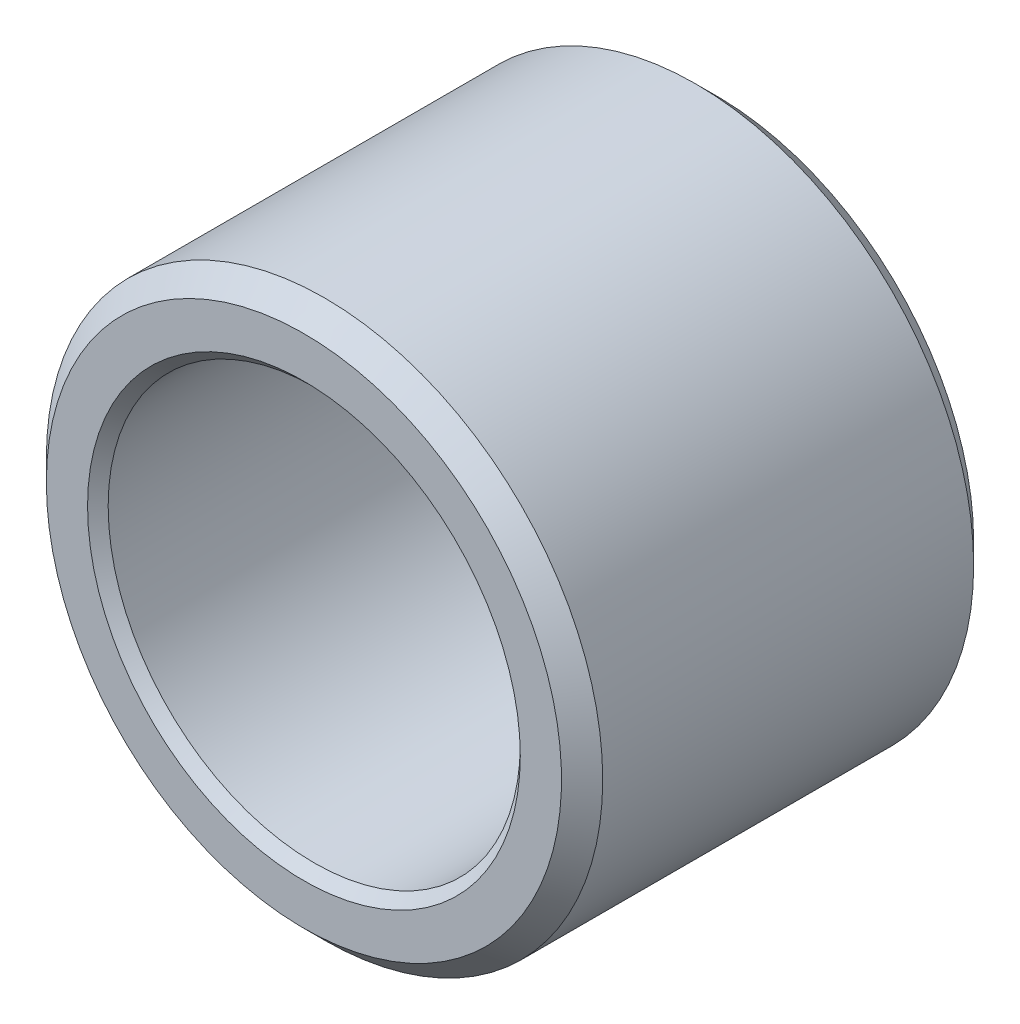
from build123d import *

# Parameters (mm, degrees)
CROQUIS1_R              = 13.5
CROQUIS1_R_2            = 10
SALIENTE_EXTRUIR1_DEPTH = 20
CHAFL_N1_SIZE           = 1
CHAFL_N2_SIZE           = 0.5


with BuildPart() as part:
    # Croquis1 → Saliente-Extruir1 (new body)
    with BuildSketch(Plane.XY):
        Circle(CROQUIS1_R)
        Circle(CROQUIS1_R_2, mode=Mode.SUBTRACT)
    extrude(amount=SALIENTE_EXTRUIR1_DEPTH)

    # Chaflán1
    chafl_n1_edges = [part.edges().sort_by_distance(p)[0] for p in [
        (-13.5, 0, 0),
        (-13.5, 0, 20),
    ]]
    chamfer(chafl_n1_edges, length=CHAFL_N1_SIZE)

    # Chaflán2
    chafl_n2_edges = [part.edges().sort_by_distance(p)[0] for p in [
        (-10, 0, 0),
        (-10, 0, 20),
    ]]
    chamfer(chafl_n2_edges, length=CHAFL_N2_SIZE)


solid = part.part
